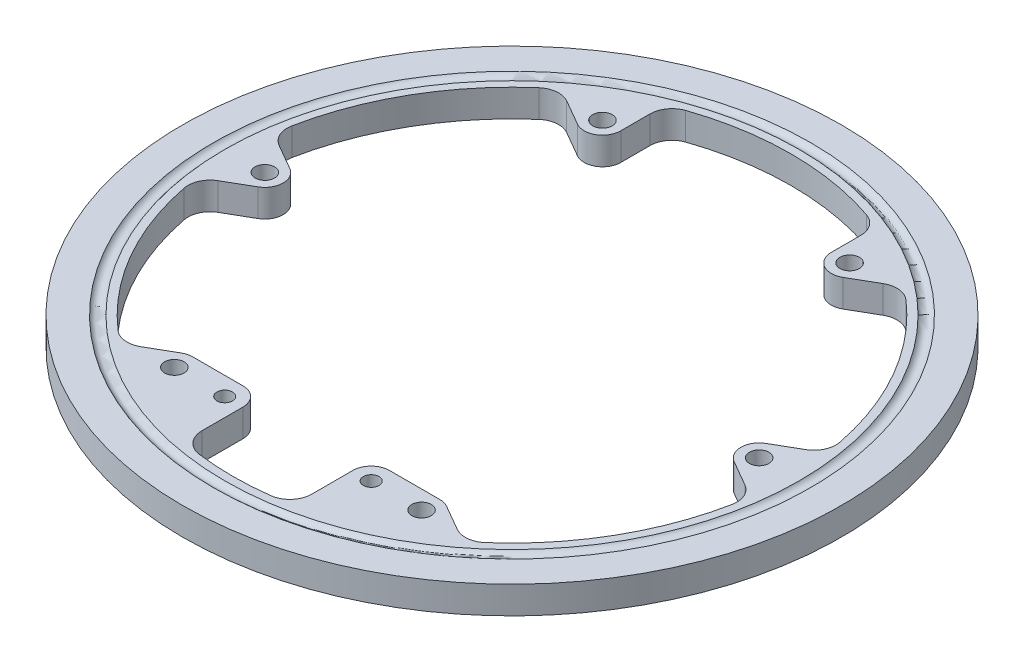
from build123d import *

# Parameters (mm, degrees)
SKETCH1_R                = 114.3
SKETCH1_R_2              = 96.8375
BOSS_EXTRUDE1_DEPTH      = 9.525
BOSS_EXTRUDE2_DEPTH      = 9.525
FILLET2_R                = 7.62
CIRPATTERN1_COUNT        = 6
FILLET2_OF_CIRPATTERN1_R = 7.62
F_1_4_CLEARANCE_HOLE1_D  = 6.7564
SKETCH2_R                = 2.38125
BOSS_EXTRUDE3_START      = -9.525
BOSS_EXTRUDE3_DEPTH      = 9.525
FILLET3_R                = 7.62
F_1_4_28_TAPPED_HOLE1_D  = 5.4102


with BuildPart() as part:
    # Sketch1 → Boss-Extrude1 (new body)
    with BuildSketch(Plane(origin=(0, 0, 0), x_dir=(1, 0, 0), z_dir=(0, 1, 0))):
        with Locations(Location((0, 0, 0), (0, 0, 90))):
            Circle(SKETCH1_R)
        with Locations(Location((0, 0, 0), (0, 0, 90))):
            Circle(SKETCH1_R_2, mode=Mode.SUBTRACT)
    extrude(amount=BOSS_EXTRUDE1_DEPTH)

    # Sketch3 → Boss-Extrude2 (add)
    with BuildSketch(Plane.XZ):
        with BuildLine():
            Line((95.930274374, -13.224366326), (82.55, -5.499261314))
            ThreePointArc((82.55, -5.499261314), (79.375, 0), (82.55, 5.499261314))
            Line((82.55, 5.499261314), (95.930274374, 13.224366326))
            ThreePointArc((95.930274374, 13.224366326), (96.8375, 0), (95.930274374, -13.224366326))
        make_face()
    boss_extrude2 = extrude(amount=-BOSS_EXTRUDE2_DEPTH)

    # Fillet2
    fillet2_edges = [part.edges().sort_by_distance(p)[0] for p in [
        (95.930274374, 4.7625, -13.224366326),
        (95.930274374, 4.7625, 13.224366326),
    ]]
    fillet(fillet2_edges, radius=FILLET2_R)

    # CirPattern1: Boss-Extrude2 ×6 about axis
    cirpattern1_axis = Axis((0, 0, 0), (0, 1, 0))
    for i in range(1, CIRPATTERN1_COUNT):
        add(boss_extrude2.rotate(cirpattern1_axis, i * 360 / CIRPATTERN1_COUNT))

    # Fillet2 of CirPattern1
    fillet2_of_cirpattern1_edges = [part.edges().sort_by_distance(p)[0] for p in [
        (36.5125, 4.7625, -89.690237763),
        (59.417774374, 4.7625, -76.465871437),
        (-59.417774374, 4.7625, -76.465871437),
        (-36.5125, 4.7625, -89.690237763),
        (-95.930274374, 4.7625, 13.224366326),
        (-95.930274374, 4.7625, -13.224366326),
        (-36.5125, 4.7625, 89.690237763),
        (-59.417774374, 4.7625, 76.465871437),
        (59.417774374, 4.7625, 76.465871437),
        (36.5125, 4.7625, 89.690237763),
    ]]
    fillet(fillet2_of_cirpattern1_edges, radius=FILLET2_OF_CIRPATTERN1_R)

    # 1/4 Clearance Hole1 (through all)
    with Locations(Plane(origin=(0, 0, 0), x_dir=(-1, 0, 0), z_dir=(0, -1, 0))):
        with Locations((-42.8625, 74.240027739), (42.8625, 74.240027739), (85.725, 0), (42.8625, -74.240027739), (-42.8625, -74.240027739), (-85.725, 0)):
            Hole(F_1_4_CLEARANCE_HOLE1_D / 2)

    # Sketch2 → Cut-Revolve1 (revolve, cut)
    with BuildSketch(Plane(origin=(0, 0, 0), x_dir=(0, 0, -1), z_dir=(1, 0, 0)), mode=Mode.PRIVATE) as cut_revolve1_sk:
        with Locations((-101.6, 10.795)):
            Circle(SKETCH2_R)
        with Locations((-101.6, -1.27)):
            Circle(SKETCH2_R)
    revolve(cut_revolve1_sk.sketch.rotate(Axis((0, 0, 0), (0, 1, 0)), 180), axis=Axis((0, 0, 0), (0, 1, 0)), mode=Mode.SUBTRACT)

    # Sketch7 → Boss-Extrude3 (add)
    with BuildSketch(Plane(origin=(0, 9.525, 0), x_dir=(1, 0, 0), z_dir=(0, 1, 0)).offset(BOSS_EXTRUDE3_START)):
        with BuildLine():
            Line((42.8625, -67.890027739), (25.4, -67.890027739))
            ThreePointArc((25.4, -67.890027739), (20.909871939, -69.749899679), (19.05, -74.240027739))
            Line((19.05, -74.240027739), (19.05, -94.94524162))
            ThreePointArc((19.05, -94.94524162), (25.259903299, -93.484965056), (31.360186833, -91.618994145))
            ThreePointArc((31.360186833, -91.618994145), (35.092023113, -88.840241596), (36.5125, -84.409630671))
            Line((36.5125, -84.409630671), (36.5125, -74.240027739))
            ThreePointArc((36.5125, -74.240027739), (38.372371939, -69.749899679), (42.8625, -67.890027739))
        make_face()
        with BuildLine():
            Line((-42.8625, -67.890027739), (-25.4, -67.890027739))
            ThreePointArc((-25.4, -67.890027739), (-20.909871939, -69.749899679), (-19.05, -74.240027739))
            Line((-19.05, -74.240027739), (-19.05, -94.94524162))
            ThreePointArc((-19.05, -94.94524162), (-25.259903299, -93.484965056), (-31.360186833, -91.618994145))
            ThreePointArc((-31.360186833, -91.618994145), (-35.092023113, -88.840241596), (-36.5125, -84.409630671))
            Line((-36.5125, -84.409630671), (-36.5125, -74.240027739))
            ThreePointArc((-36.5125, -74.240027739), (-38.372371939, -69.749899679), (-42.8625, -67.890027739))
        make_face()
    extrude(amount=BOSS_EXTRUDE3_DEPTH)

    # Fillet3
    fillet3_edges = [part.edges().sort_by_distance(p)[0] for p in [
        (19.05, 4.7625, 94.94524162),
        (-19.05, 4.7625, 94.94524162),
    ]]
    fillet(fillet3_edges, radius=FILLET3_R)

    # 1/4-28 Tapped Hole1 (through all)
    with Locations(Plane(origin=(0, 9.525, 0), x_dir=(1, 0, 0), z_dir=(0, 1, 0))):
        with Locations((25.4, -74.240027739), (-25.4, -74.240027739)):
            Hole(F_1_4_28_TAPPED_HOLE1_D / 2)


solid = part.part
